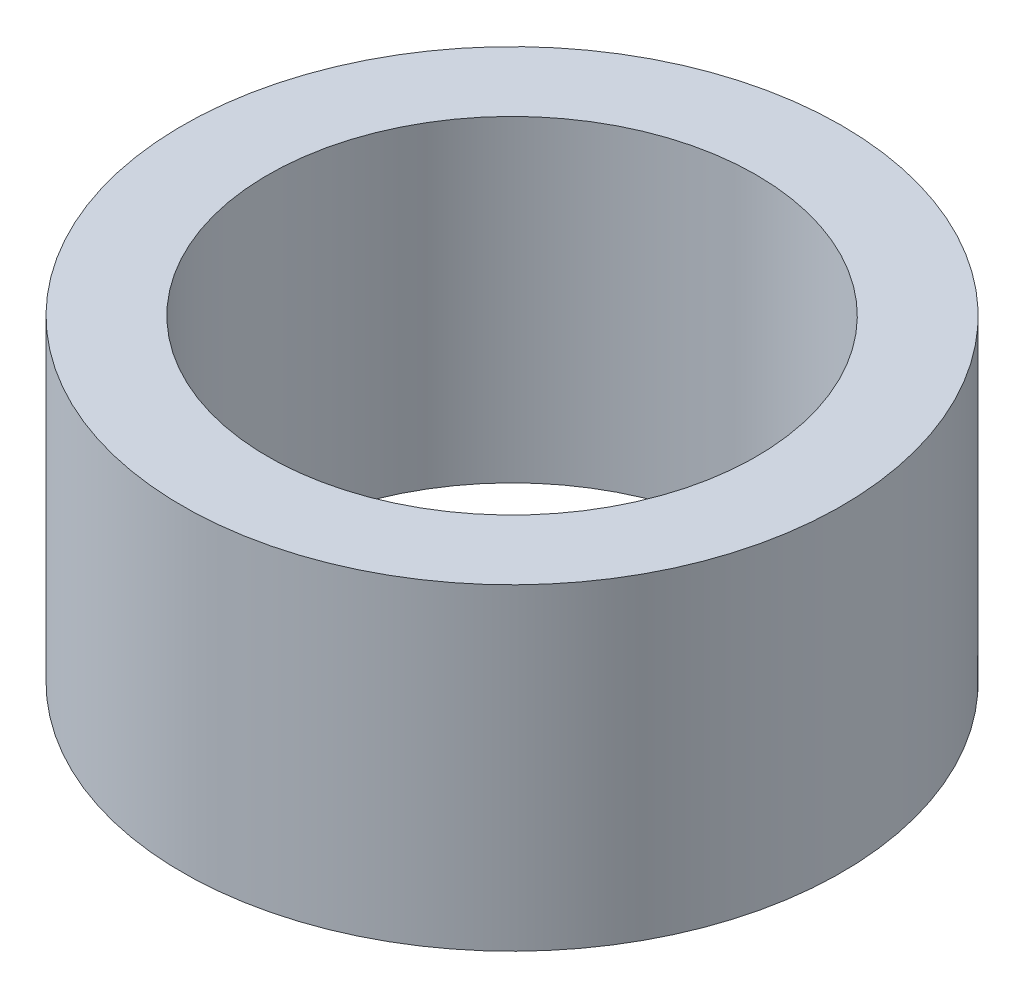
from build123d import *

# Parameters (mm, degrees)
SKETCH1_R           = 6.75
SKETCH1_R_2         = 5
BOSS_EXTRUDE1_DEPTH = 6.5


with BuildPart() as part:
    # Sketch1 → Boss-Extrude1 (new body)
    with BuildSketch(Plane(origin=(0, 0, 0), x_dir=(1, 0, 0), z_dir=(0, 1, 0))):
        with Locations(Location((0, 0, 0), (0, 0, 90))):
            Circle(SKETCH1_R)
        with Locations(Location((0, 0, 0), (0, 0, 90))):
            Circle(SKETCH1_R_2, mode=Mode.SUBTRACT)
    extrude(amount=BOSS_EXTRUDE1_DEPTH)


solid = part.part
